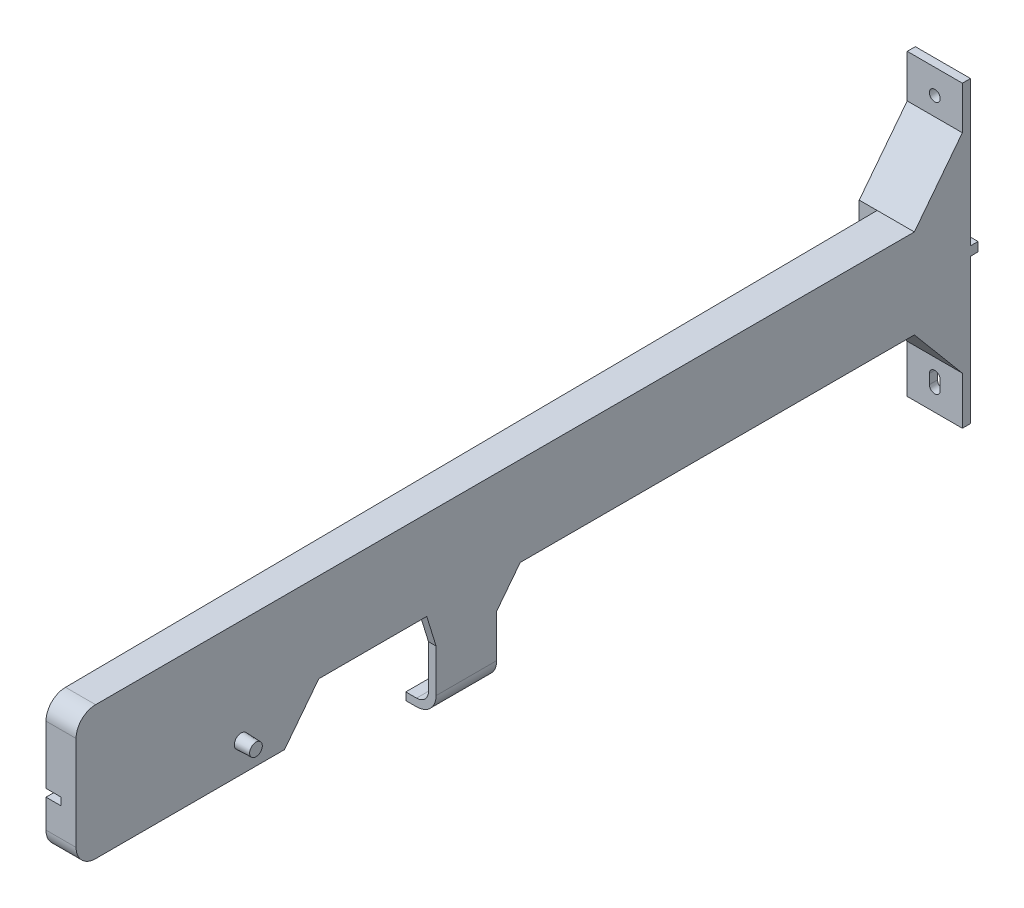
from build123d import *

# Parameters (mm, degrees)
BOSS_EXTRUDE1_DEPTH = 12.6
BOSS_EXTRUDE2_DEPTH = 23.1
BOSS_EXTRUDE3_DEPTH = 3.175
SKETCH1_5_W         = 25.4
SKETCH1_5_H         = 3.175
BOSS_EXTRUDE4_DEPTH = 12.7
FILLET1_R           = 5
FILLET2_R           = 8.175
CUT_EXTRUDE1_DEPTH  = 6.35
CUT_EXTRUDE2_REACH  = 386.06
SKETCH3_R           = 2.275
SKETCH4_W           = 23.1
SKETCH4_H           = 3.8
SKETCH4_W_2         = 3.8
SKETCH4_H_2         = 76.45
EXTRUDE_THIN1_DEPTH = 3.15
SKETCH5_R           = 2.875
BOSS_EXTRUDE5_DEPTH = 6.2
BOSS_EXTRUDE5_TAPER = 2
BOSS_EXTRUDE6_DEPTH = 3.28


with BuildPart() as part:
    # Sketch1 → Boss-Extrude1 (new body)
    with BuildSketch(Plane(origin=(0, 0, 0), x_dir=(0, 0, -1), z_dir=(1, 0, 0))):
        Polygon((175.575, -37.35), (175.575, 0), (-175.575, 0), (-175.575, -55.88), (-88.271480231, -55.88), (-73.904922854, -37.35), (-28.686383268, -37.35), (10.475, -37.35), align=None)
    extrude(amount=-BOSS_EXTRUDE1_DEPTH)

    # Sketch1<3> → Boss-Extrude2 (add)
    with BuildSketch(Plane(origin=(0, 0, 0), x_dir=(0, 0, -1), z_dir=(1, 0, 0))):
        Polygon((199.075, -81.275), (199.075, 43.925), (195.675, 43.925), (195.675, 25.925), (175.575, 0), (175.575, -37.35), (195.675, -61.275), (195.675, -81.275), align=None)
    extrude(amount=-BOSS_EXTRUDE2_DEPTH)

    # Sketch1<4> → Boss-Extrude3 (add)
    with BuildSketch(Plane(origin=(0, 0, 0), x_dir=(0, 0, -1), z_dir=(1, 0, 0))):
        Polygon((0.628519769, -50.05), (10.475, -37.35), (-28.686383268, -37.35), (-24.771480231, -50.05), (-24.771480231, -73.025), (0.628519769, -73.025), align=None)
    extrude(amount=-BOSS_EXTRUDE3_DEPTH)

    # Sketch1<5> → Boss-Extrude4 (add)
    with BuildSketch(Plane(origin=(0, 0, 0), x_dir=(0, 0, -1), z_dir=(1, 0, 0))):
        with Locations((-12.071480231, -74.6125)):
            Rectangle(SKETCH1_5_W, SKETCH1_5_H)
    extrude(amount=-BOSS_EXTRUDE4_DEPTH)

    # Fillet1
    fillet1_edges = [part.edges().sort_by_distance(p)[0] for p in [
        (-3.175, -73.025, 12.071480231),
    ]]
    fillet(fillet1_edges, radius=FILLET1_R)

    # Fillet2
    fillet2_edges = [part.edges().sort_by_distance(p)[0] for p in [
        (-6.3, 0, 175.575),
        (-6.3, -55.88, 175.575),
        (0, -76.2, 12.071480231),
    ]]
    fillet(fillet2_edges, radius=FILLET2_R)

    # Sketch2 → Cut-Extrude1 (cut)
    with BuildSketch(Plane.ZY.offset(12.6)):
        with BuildLine():
            Line((-131.125, -32.5875), (222.402046917, -32.5875))
            ThreePointArc((222.402046917, -32.5875), (223.989546917, -34.175), (222.402046917, -35.7625))
            Line((222.402046917, -35.7625), (-131.125, -35.7625))
            ThreePointArc((-131.125, -35.7625), (-132.7125, -34.175), (-131.125, -32.5875))
        make_face()
    extrude(amount=-CUT_EXTRUDE1_DEPTH, mode=Mode.SUBTRACT)

    # Sketch3 → Cut-Extrude2 (cut, up to next)
    with BuildSketch(Plane(origin=(0, 0, -199.075), x_dir=(-1, 0, 0), z_dir=(0, 0, -1)), mode=Mode.PRIVATE) as cut_extrude2_sk1:
        with Locations((11.55, 33.65)):
            Circle(SKETCH3_R)
    cut_extrude2_tool1 = extrude(cut_extrude2_sk1.sketch, amount=-CUT_EXTRUDE2_REACH, mode=Mode.PRIVATE) & part.part
    # Sketch3 → Cut-Extrude2 (cut, up to next)
    with BuildSketch(Plane(origin=(0, 0, -199.075), x_dir=(-1, 0, 0), z_dir=(0, 0, -1)), mode=Mode.PRIVATE) as cut_extrude2_sk2:
        with BuildLine():
            Line((9.3, -72.325), (9.3, -68.275))
            ThreePointArc((9.3, -68.275), (11.55, -66.025), (13.8, -68.275))
            Line((13.8, -68.275), (13.8, -72.325))
            ThreePointArc((13.8, -72.325), (11.55, -74.575), (9.3, -72.325))
        make_face()
    cut_extrude2_tool2 = extrude(cut_extrude2_sk2.sketch, amount=-CUT_EXTRUDE2_REACH, mode=Mode.PRIVATE) & part.part
    add(cut_extrude2_tool1.solids().sort_by_distance((-11.55, 33.65, -199.075))[0], mode=Mode.SUBTRACT)
    add(cut_extrude2_tool2.solids().sort_by_distance((-11.55, -70.3, -199.075))[0], mode=Mode.SUBTRACT)

    # Sketch4 → Extrude-Thin1 (add)
    with BuildSketch(Plane(origin=(0, 0, -199.075), x_dir=(-1, 0, 0), z_dir=(0, 0, -1))):
        with Locations((11.55, -18.675)):
            Rectangle(SKETCH4_W, SKETCH4_H)
        with Locations((11.55, -18.675)):
            Rectangle(SKETCH4_W_2, SKETCH4_H_2)
    extrude(amount=EXTRUDE_THIN1_DEPTH)

    # Sketch5 → Boss-Extrude5 (add)
    with BuildSketch(Plane(origin=(0, 0, 0), x_dir=(0, 0, -1), z_dir=(1, 0, 0))):
        with Locations((-106.425, -43.625)):
            Circle(SKETCH5_R)
    extrude(amount=BOSS_EXTRUDE5_DEPTH, taper=BOSS_EXTRUDE5_TAPER)

    # Sketch6 → Boss-Extrude6 (add)
    with BuildSketch(Plane(origin=(0, 0, 0), x_dir=(1, 0, 0), z_dir=(0, 1, 0))):
        Polygon((-12.6, 175.575), (-15.6, 175.575), (-12.6, -167.4), align=None)
    extrude(amount=-BOSS_EXTRUDE6_DEPTH)


solid = part.part
